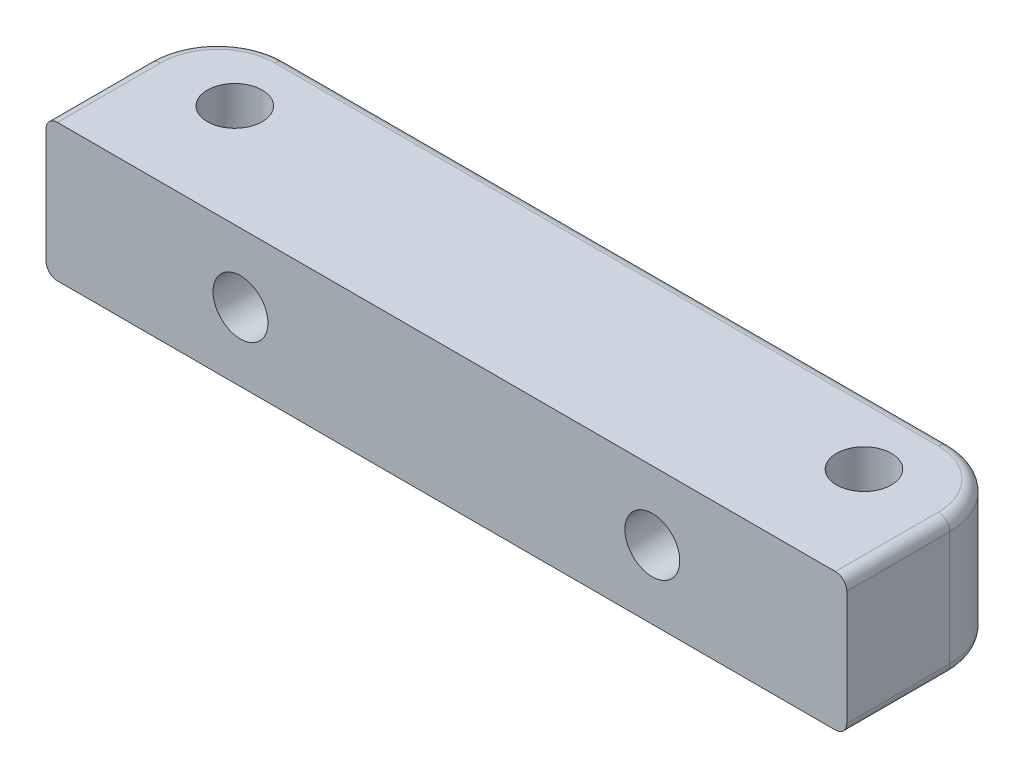
from build123d import *

# Parameters (mm, degrees)
SKETCH2_W           = 70
SKETCH2_H           = 15
SKETCH2_R           = 2.4
BOSS_EXTRUDE1_DEPTH = 6
SKETCH4_R           = 2.4
CUT_EXTRUDE1_DEPTH  = 39.548670535
FILLET1_R           = 6
FILLET2_R           = 1
SKETCH5_R           = 4.5
CUT_EXTRUDE2_DEPTH  = 5
CHAMFER1_SIZE       = 0.4


with BuildPart() as part:
    # Sketch2 → Boss-Extrude1 (new, symmetric)
    with BuildSketch(Plane(origin=(0, 0, 0), x_dir=(1, 0, 0), z_dir=(0, 1, 0))):
        Rectangle(SKETCH2_W, SKETCH2_H)
        with Locations(Location((-27.5, 1.5, 0), (0, 0, 270))):
            Circle(SKETCH2_R, mode=Mode.SUBTRACT)
        with Locations(Location((27.5, 1.5, 0), (0, 0, 90))):
            Circle(SKETCH2_R, mode=Mode.SUBTRACT)
    extrude(amount=BOSS_EXTRUDE1_DEPTH, both=True)

    # Sketch4 → Cut-Extrude1 (cut, through all)
    with BuildSketch(Plane.XY.offset(7.5)):
        with Locations((-18, 0)):
            Circle(SKETCH4_R)
        with Locations(Location((18, 0, 0), (0, 0, 180))):
            Circle(SKETCH4_R)
    extrude(amount=-CUT_EXTRUDE1_DEPTH, mode=Mode.SUBTRACT)

    # Fillet1
    fillet1_edges = [part.edges().sort_by_distance(p)[0] for p in [
        (-35, 0, -7.5),
        (35, 0, -7.5),
    ]]
    fillet(fillet1_edges, radius=FILLET1_R)

    # Fillet2
    fillet2_edges = [part.edges().sort_by_distance(p)[0] for p in [
        (35, 6, 3),
        (-35, -6, 3),
        (-35, 6, 3),
        (0, -6, -7.5),
        (33.242640687, -6, -5.742640687),
        (-33.242640687, -6, -5.742640687),
        (0, 6, -7.5),
        (33.242640687, 6, -5.742640687),
        (-33.242640687, 6, -5.742640687),
        (35, -6, 3),
    ]]
    fillet(fillet2_edges, radius=FILLET2_R)

    # Sketch5 → Cut-Extrude2 (cut)
    with BuildSketch(Plane(origin=(0, 0, -7.5), x_dir=(-1, 0, 0), z_dir=(0, 0, -1))):
        with Locations((-18, 0)):
            Circle(SKETCH5_R)
        with Locations((18, 0)):
            Circle(SKETCH5_R)
    extrude(amount=-CUT_EXTRUDE2_DEPTH, mode=Mode.SUBTRACT)

    # Chamfer1
    chamfer1_edges = [part.edges().sort_by_distance(p)[0] for p in [
        (22.5, 0, -7.5),
        (-13.5, 0, -7.5),
    ]]
    chamfer(chamfer1_edges, length=CHAMFER1_SIZE)


solid = part.part
